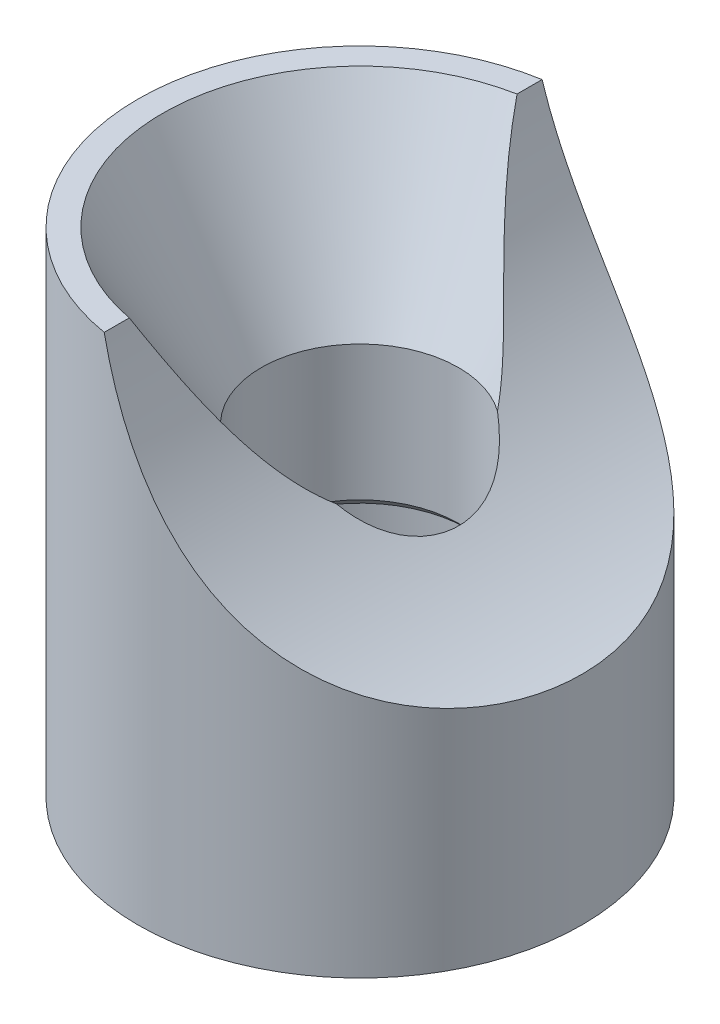
from build123d import *

# Parameters (mm, degrees)
SKETCH1_R               = 4.5
SKETCH1_R_2             = 2
BOSS_EXTRUDE1_DEPTH     = 10
CHAMFER1_SIZE           = 2
CHAMFER1_SIZE2          = 3.464101615
SKETCH2_R               = 2.25
CUT_EXTRUDE2_DEPTH      = 3.6
CUT_EXTRUDE3_DEPTH      = 12.853269591
CUT_EXTRUDE3_DEPTH_BACK = 12.853269591
SKETCH3_R               = 8
CHAMFER2_SIZE           = 0.2


with BuildPart() as part:
    # Sketch1 → Boss-Extrude1 (new body)
    with BuildSketch(Plane(origin=(0, 0, 0), x_dir=(1, 0, 0), z_dir=(0, 1, 0))):
        with Locations(Location((0, 0, 0), (0, 0, 270))):
            Circle(SKETCH1_R)
        with Locations(Location((0, 0, 0), (0, 0, 270))):
            Circle(SKETCH1_R_2, mode=Mode.SUBTRACT)
    extrude(amount=BOSS_EXTRUDE1_DEPTH)

    # Chamfer1
    chamfer1_edges = [part.edges().sort_by_distance(p)[0] for p in [
        (0, 10, -2),
    ]]
    chamfer1_side = [part.faces().sort_by_distance(p)[0] for p in [
        (0, 10, -4.372720779),
    ]]
    chamfer(chamfer1_edges, length=CHAMFER1_SIZE, length2=CHAMFER1_SIZE2, reference=chamfer1_side[0])

    # Sketch2 → Cut-Extrude2 (cut)
    with BuildSketch(Plane.XZ):
        with Locations(Location((0, 0, 0), (0, 0, 270))):
            Circle(SKETCH2_R)
    extrude(amount=-CUT_EXTRUDE2_DEPTH, mode=Mode.SUBTRACT)

    # Sketch3 → Cut-Extrude3 (cut, two sides: drawn at the far end of the back side and taken through both)
    with BuildSketch(Plane.XY.offset(-CUT_EXTRUDE3_DEPTH_BACK)):
        with Locations((7, 12)):
            Circle(SKETCH3_R)
    extrude(amount=CUT_EXTRUDE3_DEPTH + CUT_EXTRUDE3_DEPTH_BACK, mode=Mode.SUBTRACT)

    # Chamfer2
    chamfer2_edges = [part.edges().sort_by_distance(p)[0] for p in [
        (0, 3.6, -2),
        (0, 0, 2.25),
    ]]
    chamfer(chamfer2_edges, length=CHAMFER2_SIZE)


solid = part.part
